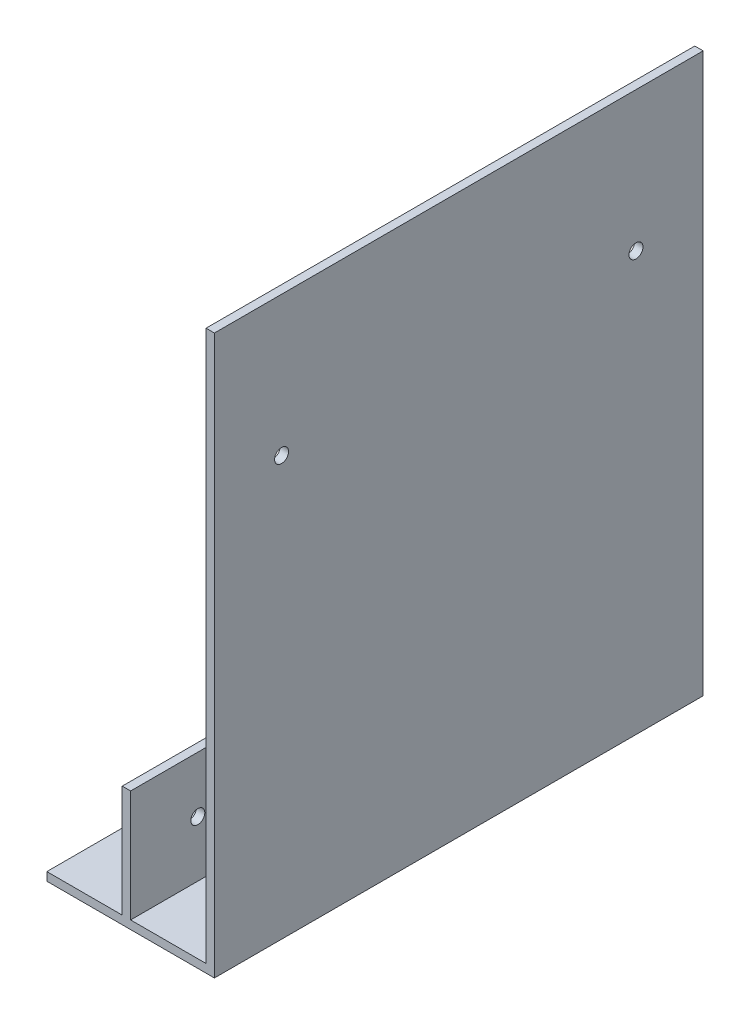
from build123d import *

# Parameters (mm, degrees)
BOSS_EXTRUDE1_DEPTH     = 350
CUT_EXTRUDE1_DEPTH      = 531.758890646
CUT_EXTRUDE1_DEPTH_BACK = 531.758890646
SKETCH2_R               = 3
SKETCH3_R               = 11
SKETCH3_R_2             = 5
CUT_EXTRUDE2_DEPTH      = 515.987214376
SKETCH4_R               = 5
CUT_EXTRUDE3_DEPTH      = 525.030372184


with BuildPart() as part:
    # Sketch1 → Boss-Extrude1 (new body)
    with BuildSketch(Plane.XY):
        Polygon((3, 58.976984506), (3, -21.023015494), (57, -21.023015494), (57, 372.976984506), (63, 372.976984506), (63, -27.023015494), (57, -27.023015494), (-57, -27.023015494), (-57, -21.023015494), (-3, -21.023015494), (-3, 58.976984506), align=None)
    extrude(amount=BOSS_EXTRUDE1_DEPTH)

    # Sketch2 → Cut-Extrude1 (cut, two sides: drawn at the far end of the back side and taken through both)
    with BuildSketch(Plane(origin=(0, -21.023015494, 0), x_dir=(1, 0, 0), z_dir=(0, 1, 0)).offset(-CUT_EXTRUDE1_DEPTH_BACK)):
        with Locations((-30, -150)):
            Circle(SKETCH2_R)
        with Locations(Location((-30, -200, 0), (0, 0, 90))):
            Circle(SKETCH2_R)
        with Locations(Location((30, -200, 0), (0, 0, 90))):
            Circle(SKETCH2_R)
        with Locations(Location((30, -150, 0), (0, 0, 90))):
            Circle(SKETCH2_R)
    extrude(amount=CUT_EXTRUDE1_DEPTH + CUT_EXTRUDE1_DEPTH_BACK, mode=Mode.SUBTRACT)

    # Sketch3 → Cut-Extrude2 (cut, through all)
    with BuildSketch(Plane(origin=(3, 0, 0), x_dir=(0, 0, -1), z_dir=(1, 0, 0))):
        with Locations(Location((-175, 18.976984506, 0), (0, 0, 90))):
            Circle(SKETCH3_R)
        with Locations(Location((-301.895890035, 18.976984506, 0), (0, 0, 90))):
            Circle(SKETCH3_R_2)
        with Locations(Location((-48.104109965, 18.976984506, 0), (0, 0, 90))):
            Circle(SKETCH3_R_2)
    extrude(amount=-CUT_EXTRUDE2_DEPTH, mode=Mode.SUBTRACT)

    # Sketch4 → Cut-Extrude3 (cut, through all)
    with BuildSketch(Plane.ZY.offset(-57)):
        with Locations((48.1, 272.976984506)):
            Circle(SKETCH4_R)
        with Locations(Location((301.9, 272.976984506, 0), (0, 0, 180))):
            Circle(SKETCH4_R)
    extrude(amount=-CUT_EXTRUDE3_DEPTH, mode=Mode.SUBTRACT)


solid = part.part
